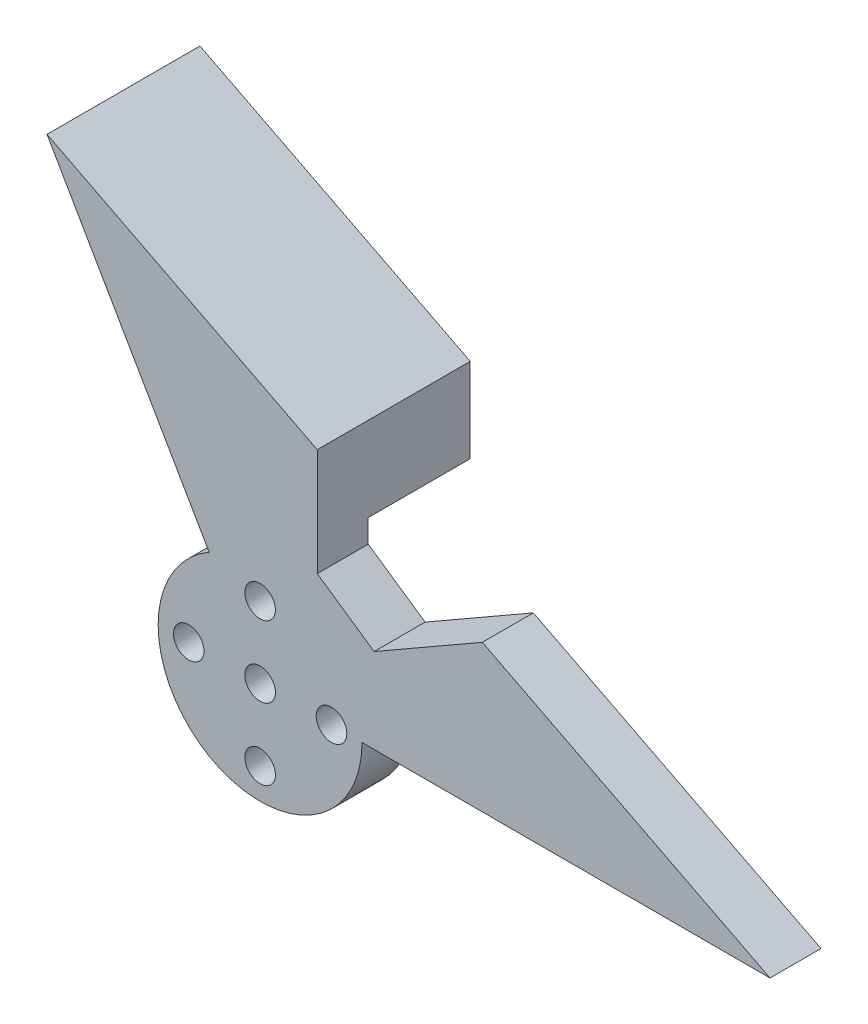
from build123d import *

# Parameters (mm, degrees)
SKETCH_1_R          = 10
EXTRUDE_1_DEPTH     = 5
EXTRUDE_2_DEPTH     = 5
CUT_EXTRUDE_1_DEPTH = 5
EXTRUDE_3_DEPTH     = 10
SKETCH_5_R          = 1.5
CUT_EXTRUDE_2_DEPTH = 10
SKETCH_6_R          = 1.5
CUT_EXTRUDE_3_DEPTH = 10


with BuildPart() as part:
    # 草图1 → 凸台-拉伸1 (new body)
    with BuildSketch(Plane.XY):
        Circle(SKETCH_1_R)
    extrude(amount=EXTRUDE_1_DEPTH)

    # 草图2 → 凸台-拉伸2 (add)
    with BuildSketch(Plane.XY.offset(5)):
        Polygon((10, 0), (50, 0), (-20.898751954, 36.197700198), (0, 0), align=None)
    extrude(amount=-EXTRUDE_2_DEPTH)

    # 草图3 → 切除-拉伸1 (cut)
    with BuildSketch(Plane.XY.offset(5)):
        Polygon((5.603154877, 25.292377819), (5.603154877, 12.141678981), (11.179717043, 8.31299451), (24.663344965, 16.053595724), align=None)
    extrude(amount=-CUT_EXTRUDE_1_DEPTH, mode=Mode.SUBTRACT)

    # 草图4 → 凸台-拉伸3 (add)
    with BuildSketch(Plane(origin=(0, 0, 0), x_dir=(-1, 0, 0), z_dir=(0, 0, -1))):
        Polygon((-5.603154877, 22.667023681), (-5.603154877, 14.403378326), (6.064261942, 10.503609794), (20.898751954, 36.197700198), align=None)
    extrude(amount=EXTRUDE_3_DEPTH)

    # 草图5 → 切除-拉伸2 (cut)
    with BuildSketch(Plane.XY.offset(5)):
        with Locations((0, 7)):
            Circle(SKETCH_5_R)
        with Locations((7, 0)):
            Circle(SKETCH_5_R)
        with Locations((0, -7)):
            Circle(SKETCH_5_R)
        with Locations((-7, 0)):
            Circle(SKETCH_5_R)
    extrude(amount=-CUT_EXTRUDE_2_DEPTH, mode=Mode.SUBTRACT)

    # 草图6 → 切除-拉伸3 (cut)
    with BuildSketch(Plane.XY.offset(5)):
        Circle(SKETCH_6_R)
    extrude(amount=-CUT_EXTRUDE_3_DEPTH, mode=Mode.SUBTRACT)


solid = part.part
